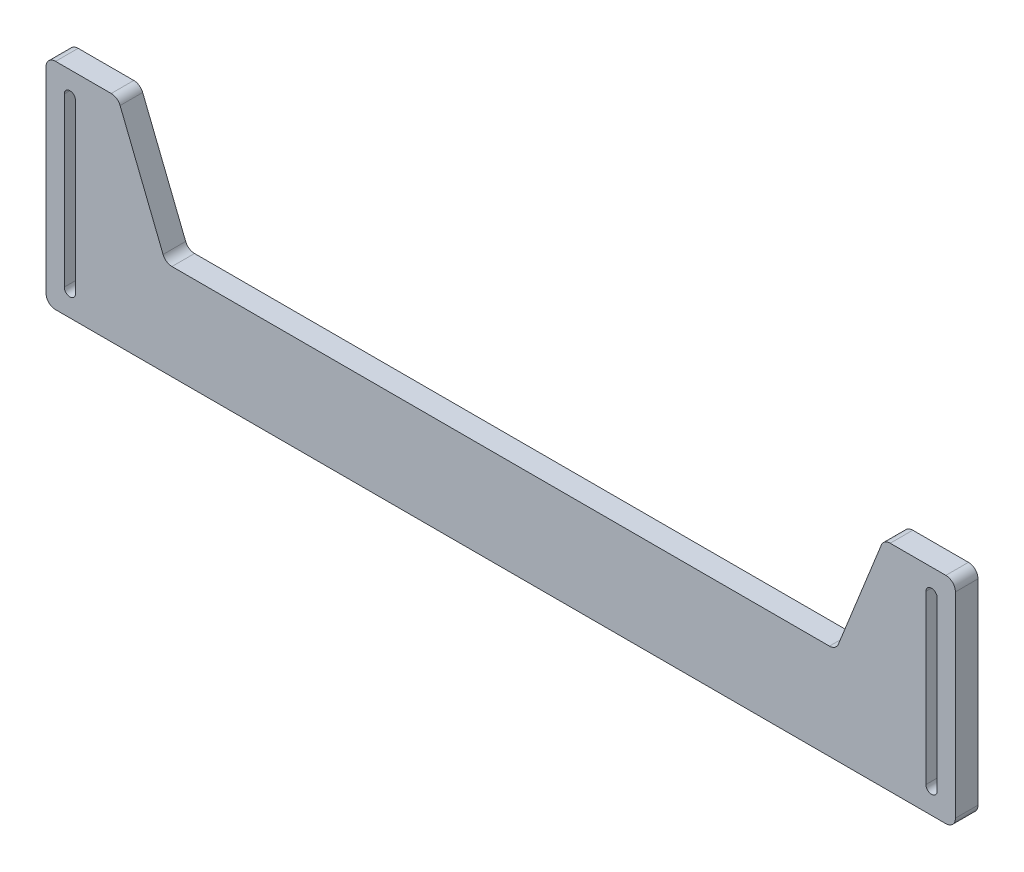
from build123d import *

# Parameters (mm, degrees)
BOSS_EXTRUDE1_DEPTH = 3
FILLET1_R           = 2.54


with BuildPart() as part:
    # Sketch1 → Boss-Extrude1 (new, symmetric)
    with BuildSketch(Plane.XY):
        Polygon((-120.825, -28.575), (-120.825, 28.575), (-101.775, 28.575), (-89.075, -3.175), (89.075, -3.175), (101.775, 28.575), (120.825, 28.575), (120.825, -28.575), align=None)
        with BuildLine():
            Line((-112.975, 22.225), (-112.975, -22.225))
            ThreePointArc((-112.975, -22.225), (-114.475, -23.725), (-115.975, -22.225))
            Line((-115.975, -22.225), (-115.975, 22.225))
            ThreePointArc((-115.975, 22.225), (-114.475, 23.725), (-112.975, 22.225))
        make_face(mode=Mode.SUBTRACT)
        with BuildLine():
            Line((115.975, 22.225), (115.975, -22.225))
            ThreePointArc((115.975, -22.225), (114.475, -23.725), (112.975, -22.225))
            Line((112.975, -22.225), (112.975, 22.225))
            ThreePointArc((112.975, 22.225), (114.475, 23.725), (115.975, 22.225))
        make_face(mode=Mode.SUBTRACT)
    extrude(amount=BOSS_EXTRUDE1_DEPTH, both=True)

    # Fillet1
    fillet1_edges = [part.edges().sort_by_distance(p)[0] for p in [
        (120.825, 28.575, 0),
        (120.825, -28.575, 0),
        (-120.825, -28.575, 0),
        (-120.825, 28.575, 0),
        (-101.775, 28.575, 0),
        (-89.075, -3.175, 0),
        (89.075, -3.175, 0),
        (101.775, 28.575, 0),
    ]]
    fillet(fillet1_edges, radius=FILLET1_R)


solid = part.part
